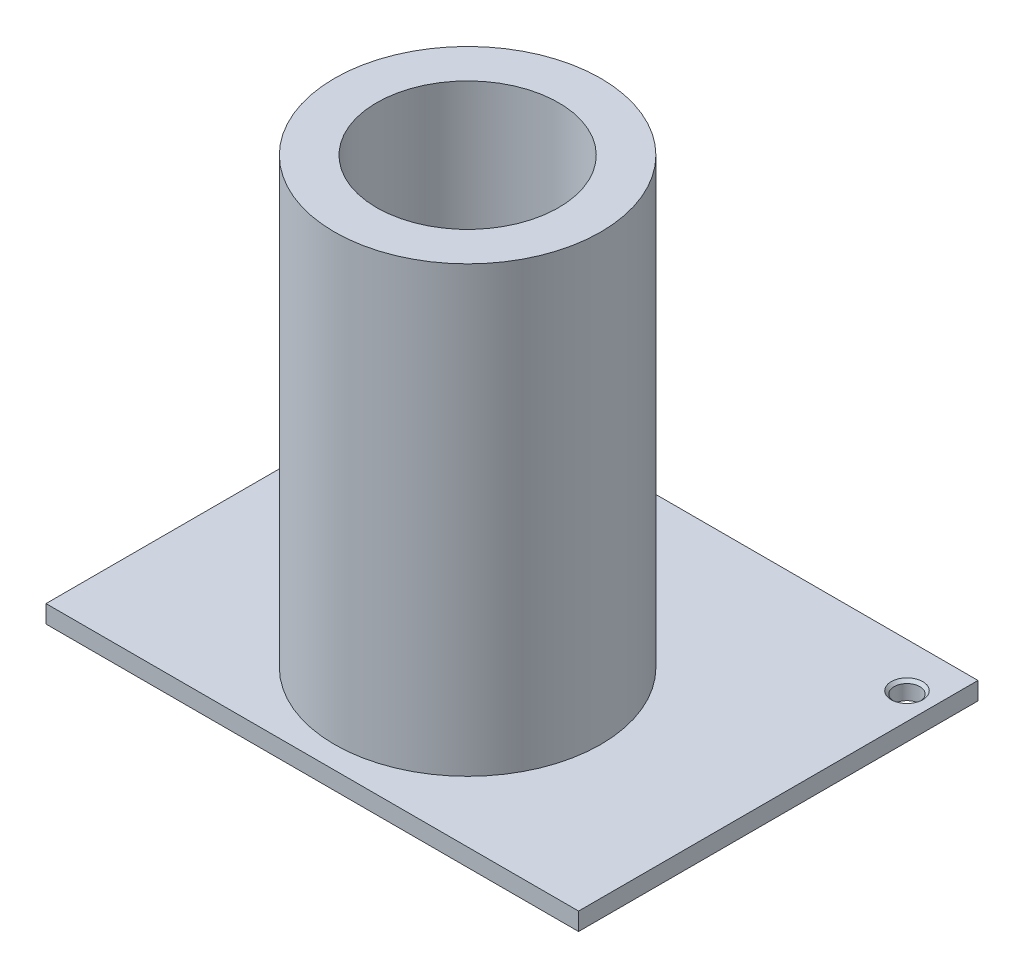
from build123d import *

# Parameters (mm, degrees)
EXTRUDE_1_DEPTH                = 2
HOLE_WIZARD_M3_5_1_D           = 2.9
HOLE_WIZARD_M3_5_1_DEPTH       = 8.8
HOLE_WIZARD_M3_5_1_CSINK_D     = 3.55
HOLE_WIZARD_M3_5_1_CSINK_ANGLE = 90
HOLE_WIZARD_M3_5_1_TIP         = 0.871247898
SKETCH_4_R                     = 15
SKETCH_4_R_2                   = 10.25
EXTRUDE_2_DEPTH                = 50


with BuildPart() as part:
    # 草图1 → 凸台-拉伸1 (new body)
    with BuildSketch(Plane(origin=(0, 0, 0), x_dir=(1, 0, 0), z_dir=(0, 1, 0))):
        Polygon((0, -15), (0, 0), (0, 30), (-30, 30), (-57, 30), (-60, 30), (-60, 0), (-60, -15), align=None)
    extrude(amount=EXTRUDE_1_DEPTH)

    # M3.5 螺纹孔1
    with Locations(Plane(origin=(0, 2, 0), x_dir=(1, 0, 0), z_dir=(0, 1, 0))):
        with Locations((-57, 25), (-3, 25)):
            CounterSinkHole(HOLE_WIZARD_M3_5_1_D / 2, HOLE_WIZARD_M3_5_1_CSINK_D / 2, depth=HOLE_WIZARD_M3_5_1_DEPTH, counter_sink_angle=HOLE_WIZARD_M3_5_1_CSINK_ANGLE)
            with Locations((0, 0, -(HOLE_WIZARD_M3_5_1_DEPTH + HOLE_WIZARD_M3_5_1_TIP / 2))):  # 118° drill point
                Cone(0, HOLE_WIZARD_M3_5_1_D / 2, HOLE_WIZARD_M3_5_1_TIP, mode=Mode.SUBTRACT)

    # 草图4 → 凸台-拉伸2 (add)
    with BuildSketch(Plane(origin=(0, 2, 0), x_dir=(1, 0, 0), z_dir=(0, 1, 0))):
        with Locations(Location((-30, 2.5, 0), (0, 0, 270))):
            Circle(SKETCH_4_R)
        with Locations(Location((-30, 2.5, 0), (0, 0, 270))):
            Circle(SKETCH_4_R_2, mode=Mode.SUBTRACT)
    extrude(amount=EXTRUDE_2_DEPTH)


solid = part.part
